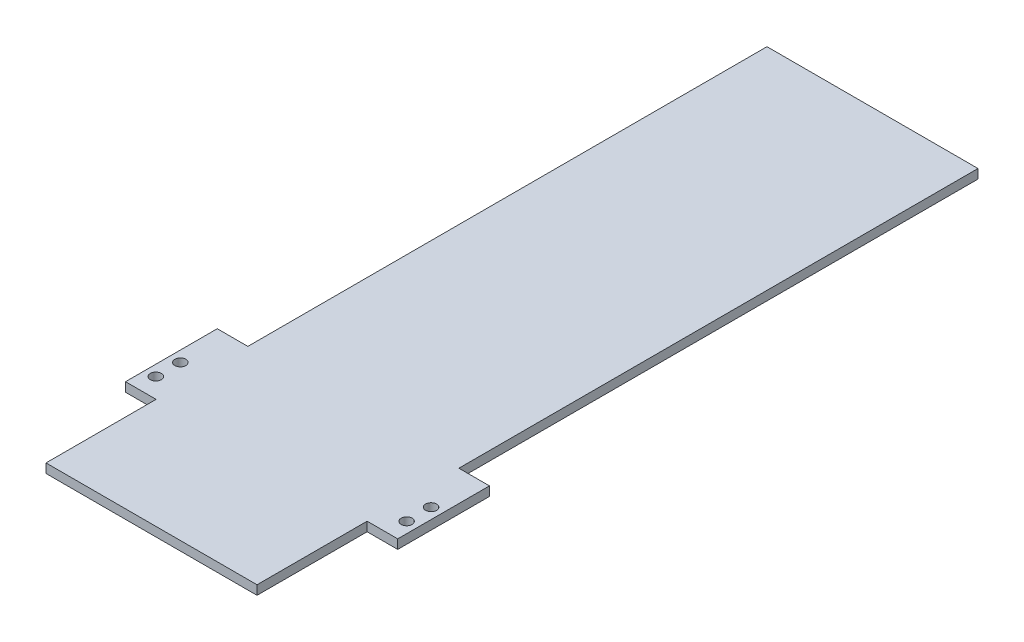
from build123d import *

# Parameters (mm, degrees)
SKETCH5_W            = 10
SKETCH5_H            = 30
BOSS_EXTRUDE5_DEPTH  = 3
M3_CLEARANCE_HOLE1_D = 3.6


with BuildPart() as part:
    # Sketch5 → Boss-Extrude5 (new body)
    with BuildSketch(Plane(origin=(0, 0, 0), x_dir=(1, 0, 0), z_dir=(0, 1, 0))):
        with Locations((-5, 51)):
            Rectangle(SKETCH5_W, SKETCH5_H)
        Polygon((0, 0), (34.5, 0), (34.5, 235.74), (0, 235.74), (0, 66), (0, 36), align=None)
        Polygon((69, 0), (69, 36), (69, 66), (69, 235.74), (34.5, 235.74), (34.5, 0), align=None)
        with Locations((74, 51)):
            Rectangle(SKETCH5_W, SKETCH5_H)
    extrude(amount=BOSS_EXTRUDE5_DEPTH)

    # M3 Clearance Hole1 (through all)
    with Locations(Plane(origin=(0, 3, 0), x_dir=(1, 0, 0), z_dir=(0, 1, 0))):
        with Locations((75.5, 50.420635549), (75.5, 42.420635549)):
            m3_clearance_hole1 = Hole(M3_CLEARANCE_HOLE1_D / 2)

    # Mirror1: M3 Clearance Hole1 across plane
    add(m3_clearance_hole1.mirror(Plane(origin=(34.5, 0, 0), x_dir=(0, 0, 1), z_dir=(1, 0, 0))), mode=Mode.SUBTRACT)


solid = part.part
